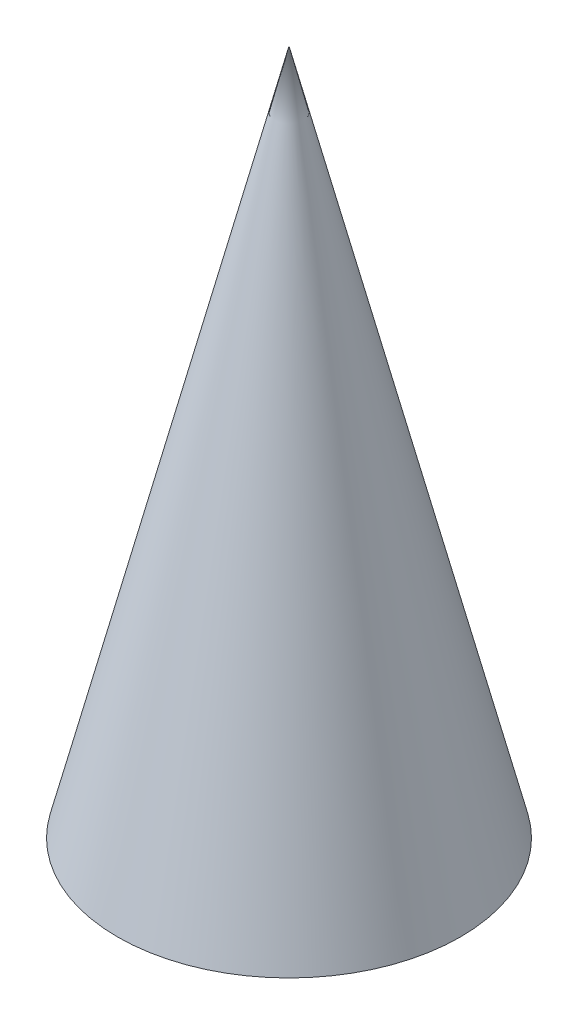
from build123d import *


with BuildPart() as part:
    # Croquis1 → Revolución1 (revolve)
    with BuildSketch(Plane.XY, mode=Mode.PRIVATE) as revoluci_n1_sk:
        Polygon((0, 0), (25, 0), (0, 100), align=None)
    revolve(revoluci_n1_sk.sketch.rotate(Axis((0, 100, 0), (0, -1, 0)), 270), axis=Axis((0, 100, 0), (0, -1, 0)))


solid = part.part
